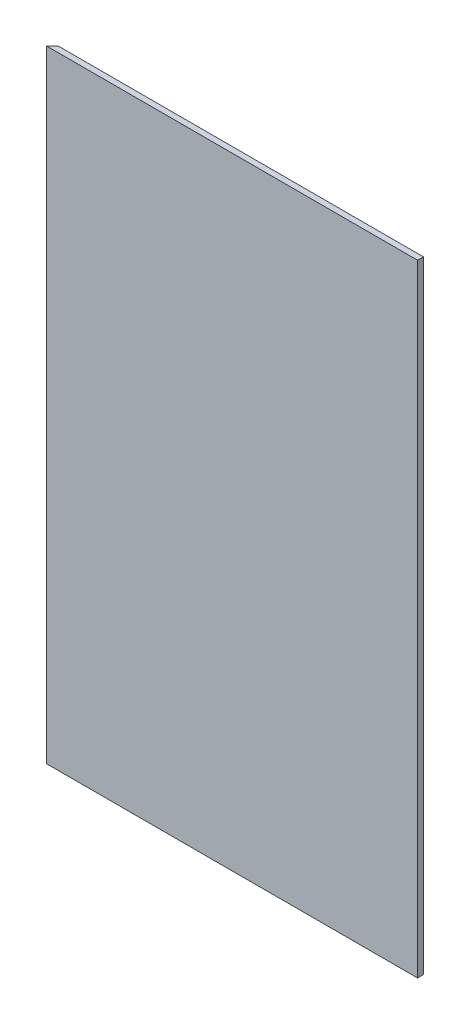
from build123d import *

# Parameters (mm, degrees)
SKETCH_1_W          = 191
SKETCH_1_H          = 320
EXTRUDE_1_DEPTH     = 3
CUT_EXTRUDE_4_DEPTH = 334.959952689


with BuildPart() as part:
    # 草图1 → 凸台-拉伸1 (new body)
    with BuildSketch(Plane.XY):
        Rectangle(SKETCH_1_W, SKETCH_1_H)
    extrude(amount=EXTRUDE_1_DEPTH)

    # 草图4 → 切除-拉伸4 (cut, through all)
    with BuildSketch(Plane(origin=(0, 160, 0), x_dir=(1, 0, 0), z_dir=(0, 1, 0))):
        Polygon((-95.5, -3), (-95.5, 0), (-92.5, 0), align=None)
    extrude(amount=-CUT_EXTRUDE_4_DEPTH, mode=Mode.SUBTRACT)


solid = part.part
